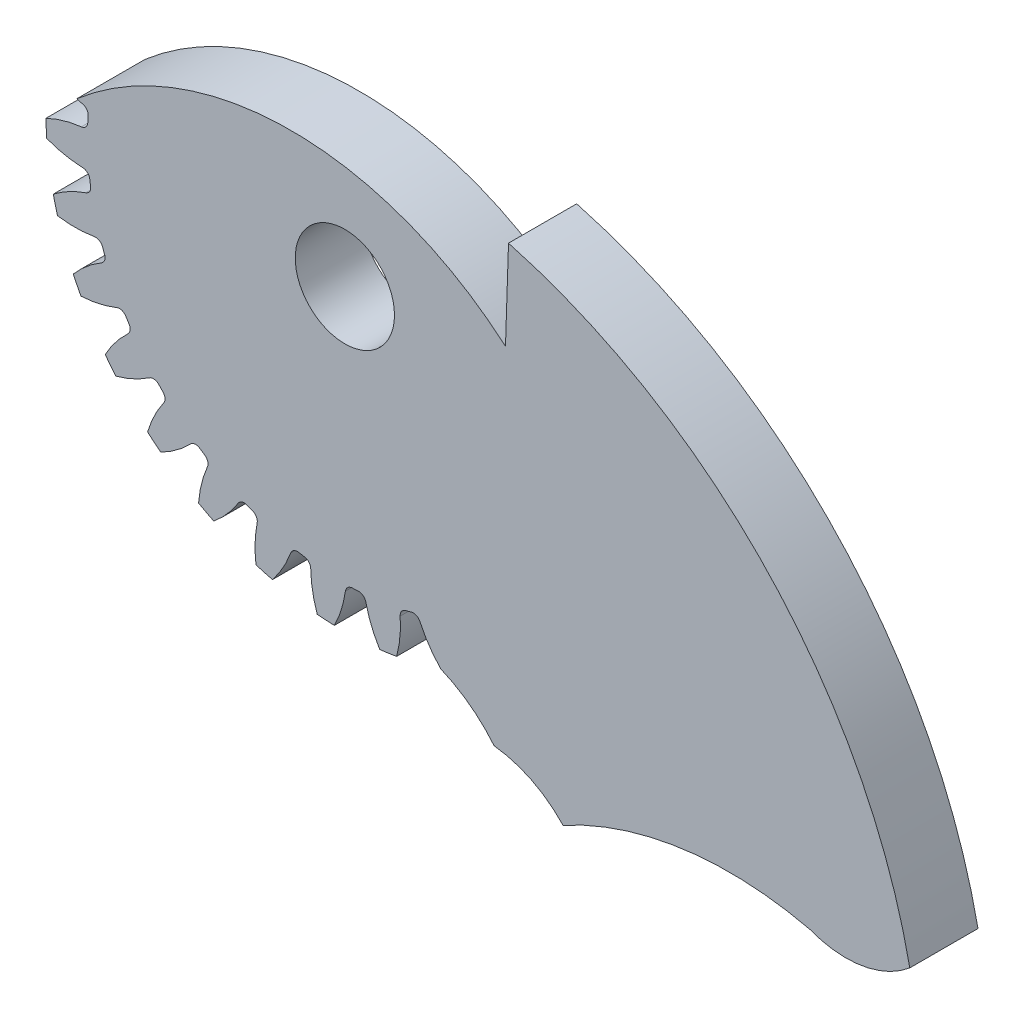
from build123d import *

# Parameters (mm, degrees)
SKETCH3_R               = 40.64
GEARBODY_DEPTH          = 25.4
TOOTHCUT_DEPTH          = 63.836129734
CIRPATTERN1_COUNT       = 30
BOREDIA_R               = 9.525
BORE_DEPTH              = 12700
CUT_EXTRUDE1_DEPTH      = 63.817881856
BOSS_EXTRUDE1_DEPTH     = 25.4
CUT_EXTRUDE2_DEPTH      = 97.248090867
CUT_EXTRUDE2_DEPTH_BACK = 97.248090867
CUT_EXTRUDE3_DEPTH      = 94.297837255
CUT_EXTRUDE3_DEPTH_BACK = 94.297837255
SKETCH8_R               = 10.901188975
SKETCH8_R_2             = 6.746875
BOSS_EXTRUDE2_DEPTH     = 9.271
CUT_EXTRUDE4_DEPTH      = 94.297837255
CUT_EXTRUDE4_DEPTH_BACK = 94.297837255


with BuildPart() as part:
    # Sketch3 → gearBody (new body)
    with BuildSketch(Plane.XY):
        Circle(SKETCH3_R)
    extrude(amount=GEARBODY_DEPTH)

    # Sketch2 → toothCut (cut, through all)
    with BuildSketch(Plane.XY):
        with BuildLine():
            ThreePointArc((34.901466352, -2.640387833), (34.929801576, -2.234493965), (34.953416534, -1.828298136))
            ThreePointArc((34.953416534, -1.828298136), (35.218972856, -1.205360668), (35.823821616, -0.900845929))
            ThreePointArc((35.823821616, -0.900845929), (41.902420255, 1.180053047), (46.567899911, 5.597382731))
            ThreePointArc((46.567899911, 5.597382731), (46.807414621, -2.994316622), (45.4750933, -11.485464069))
            ThreePointArc((45.4750933, -11.485464069), (41.410501506, -6.509663078), (35.646600115, -3.671187658))
            ThreePointArc((35.646600115, -3.671187658), (35.08548304, -3.292084932), (34.901466352, -2.640387833))
        make_face()
    toothcut = extrude(amount=TOOTHCUT_DEPTH, mode=Mode.SUBTRACT)

    # CirPattern1: toothCut ×30 about axis
    cirpattern1_axis = Axis((0, 0, 0), (0, 0, 1))
    for i in range(1, CIRPATTERN1_COUNT):
        add(toothcut.rotate(cirpattern1_axis, i * 360 / CIRPATTERN1_COUNT), mode=Mode.SUBTRACT)

    # boreDia → bore (cut, symmetric)
    with BuildSketch(Plane.XY):
        Circle(BOREDIA_R)
    extrude(amount=BORE_DEPTH, both=True, mode=Mode.SUBTRACT)

    # Sketch4 → Cut-Extrude1 (cut, through all)
    with BuildSketch(Plane.XY.offset(25.4)):
        with BuildLine():
            ThreePointArc((-43.554352266, 3.655257975), (1.299887875, 18.694416006), (46.382242057, 4.353548725))
            ThreePointArc((46.382242057, 4.353548725), (1.078287813, 47.235471327), (-43.554352266, 3.655257975))
        make_face()
    extrude(amount=-CUT_EXTRUDE1_DEPTH, mode=Mode.SUBTRACT)

    # Sketch5 → Boss-Extrude1 (add)
    with BuildSketch(Plane.XY.offset(25.4)):
        with BuildLine():
            Line((-40.520407877, 5.797825642), (17.717099168, 12.48871132))
            Line((17.717099168, 12.48871132), (8.960832095, -26.928019276))
            Line((8.960832095, -26.928019276), (13.028048789, -38.495188592))
            ThreePointArc((13.028048789, -38.495188592), (20.295398902, -43.922390287), (24.158608262, -52.128760334))
            ThreePointArc((24.158608262, -52.128760334), (42.8096102, -43.78426266), (63.240034891, -44.081351255))
            ThreePointArc((63.240034891, -44.081351255), (70.340218446, -44.816365594), (76.818795497, -41.819551953))
            ThreePointArc((76.818795497, -41.819551953), (30.86783196, 13.330528242), (-40.520407877, 5.797825642))
        make_face()
    extrude(amount=-BOSS_EXTRUDE1_DEPTH)

    # Sketch6 → Cut-Extrude2 (cut, two sides: drawn at the far end of the back side and taken through both)
    with BuildSketch(Plane(origin=(0, 0, 0), x_dir=(1, 0, 0), z_dir=(0, 1, 0)).offset(-CUT_EXTRUDE2_DEPTH_BACK)):
        Polygon((-46.138376309, -9.271), (97.816171298, -9.271), (71.932802696, -41.15378122), (-48.678279579, -38.064709676), align=None)
    extrude(amount=CUT_EXTRUDE2_DEPTH + CUT_EXTRUDE2_DEPTH_BACK, mode=Mode.SUBTRACT)

    # Sketch7 → Cut-Extrude3 (cut, two sides: drawn at the far end of the back side and taken through both)
    with BuildSketch(Plane.XY.offset(9.271).offset(-CUT_EXTRUDE3_DEPTH_BACK)):
        with BuildLine():
            Line((21.841106952, 3.893976142), (22.251299285, 16.241253613))
            Line((22.251299285, 16.241253613), (23.901139449, 23.204831581))
            Line((23.901139449, 23.204831581), (-36.876630256, 21.261551183))
            Line((-36.876630256, 21.261551183), (-43.577597148, 3.302959913))
            Line((-43.577597148, 3.302959913), (-36.448484964, 3.893976142))
            ThreePointArc((-36.448484964, 3.893976142), (-7.303689006, 14.730432769), (21.841106952, 3.893976142))
        make_face()
    extrude(amount=CUT_EXTRUDE3_DEPTH + CUT_EXTRUDE3_DEPTH_BACK, mode=Mode.SUBTRACT)

    # Sketch8 → Boss-Extrude2 (add)
    with BuildSketch(Plane.XY.offset(9.271)):
        Circle(SKETCH8_R)
        Circle(SKETCH8_R_2, mode=Mode.SUBTRACT)
    extrude(amount=-BOSS_EXTRUDE2_DEPTH)

    # Sketch9 → Cut-Extrude4 (cut, two sides: drawn at the far end of the back side and taken through both)
    with BuildSketch(Plane.XY.offset(9.271).offset(-CUT_EXTRUDE4_DEPTH_BACK)):
        with BuildLine():
            Line((20.295398902, -43.922390287), (23.1683449, -52.694459817))
            Line((23.1683449, -52.694459817), (26.579367988, -52.803988081))
            Line((26.579367988, -52.803988081), (29.661056762, -48.607867727))
            ThreePointArc((29.661056762, -48.607867727), (25.399491401, -45.423078115), (20.295398902, -43.922390287))
        make_face()
    extrude(amount=CUT_EXTRUDE4_DEPTH + CUT_EXTRUDE4_DEPTH_BACK, mode=Mode.SUBTRACT)


solid = part.part
